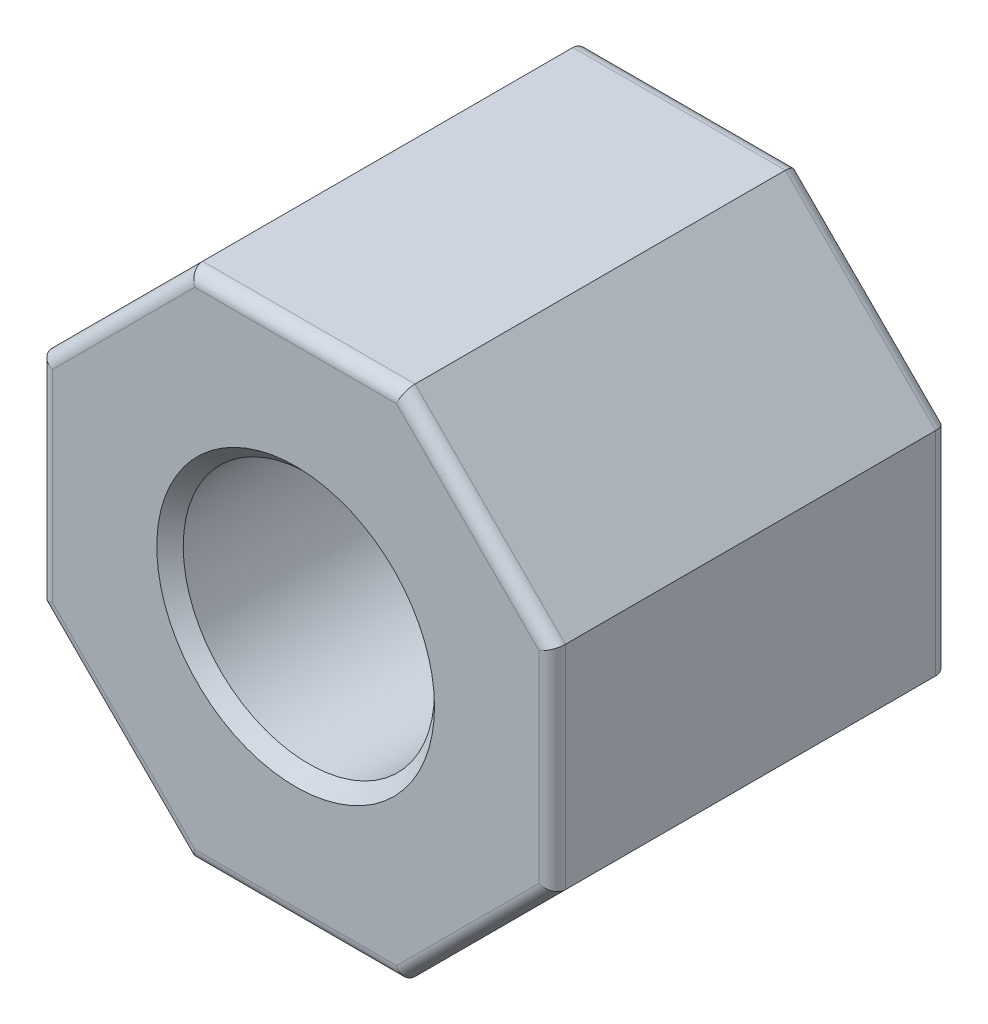
from build123d import *

# Parameters (mm, degrees)
ESTRUSIONE_ESTRUSIONE1_DEPTH = 30
SCHIZZO2_R                   = 9.5
TAGLIO_ESTRUSIONE1_DEPTH     = 41.655062299
SMUSSO1_SIZE                 = 1
RACCORDO1_R                  = 1


with BuildPart() as part:
    # Schizzo1 → Estrusione-Estrusione1 (new body)
    with BuildSketch(Plane.XY):
        Polygon((8.03635208, 19.401470183), (-8.03635208, 19.401470183), (-19.401470183, 8.03635208), (-19.401470183, -8.03635208), (-8.03635208, -19.401470183), (8.03635208, -19.401470183), (19.401470183, -8.03635208), (19.401470183, 8.03635208), align=None)
    extrude(amount=ESTRUSIONE_ESTRUSIONE1_DEPTH)

    # Schizzo2 → Taglio-Estrusione1 (cut, through all)
    with BuildSketch(Plane(origin=(0, 0, 0), x_dir=(-1, 0, 0), z_dir=(0, 0, -1))):
        Circle(SCHIZZO2_R)
    extrude(amount=-TAGLIO_ESTRUSIONE1_DEPTH, mode=Mode.SUBTRACT)

    # Smusso1
    smusso1_edges = [part.edges().sort_by_distance(p)[0] for p in [
        (9.5, 0, 30),
        (9.5, 0, 0),
    ]]
    chamfer(smusso1_edges, length=SMUSSO1_SIZE)

    # Raccordo1
    raccordo1_edges = [part.edges().sort_by_distance(p)[0] for p in [
        (19.401470183, 0, 0),
        (13.718911131, -13.718911131, 0),
        (-13.718911131, 13.718911131, 30),
        (0, -19.401470183, 0),
        (-13.718911131, -13.718911131, 0),
        (-19.401470183, 0, 0),
        (-13.718911131, 13.718911131, 0),
        (0, 19.401470183, 0),
        (-19.401470183, 0, 30),
        (-13.718911131, -13.718911131, 30),
        (0, -19.401470183, 30),
        (13.718911131, -13.718911131, 30),
        (19.401470183, 0, 30),
        (13.718911131, 13.718911131, 30),
        (0, 19.401470183, 30),
        (13.718911131, 13.718911131, 0),
    ]]
    fillet(raccordo1_edges, radius=RACCORDO1_R)


solid = part.part
